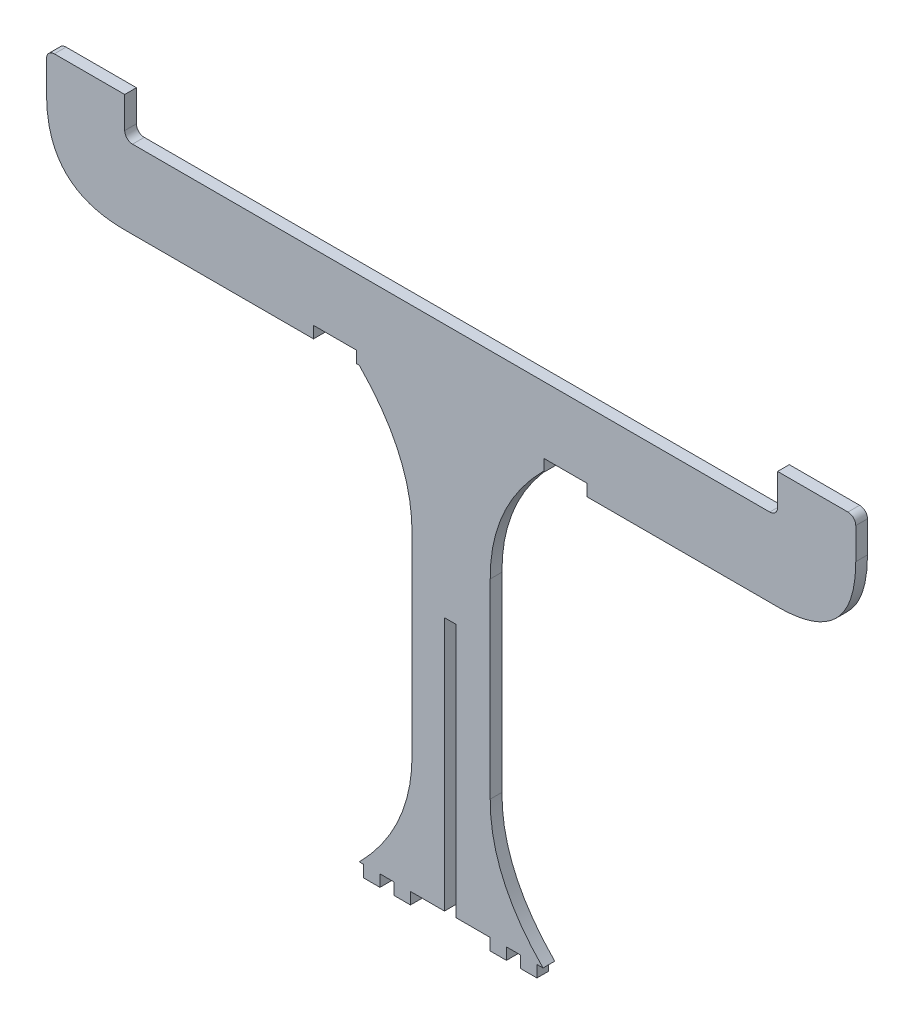
from build123d import *

# Parameters (mm, degrees)
P_IDAT_VYSUNUT_M2_DEPTH  = 3
SKICA2_W                 = 3
SKICA2_H                 = 65
ODEBRAT_VYSUNUT_M3_DEPTH = 3
SKICA3_W                 = 11
SKICA3_H                 = 5.694256757
ODEBRAT_VYSUNUT_M4_DEPTH = 3


with BuildPart() as part:
    # Skica1 → Přidat vysunutím2 (new body)
    with BuildSketch(Plane.XY):
        with BuildLine():
            Line((-90.642636358, 2.694256757), (-30.642636358, 2.694256757))
            add(Edge.make_bspline(
                [(-30.642636358, 2.694256757), (-17.025139471, -11.118063286), (-17.142636358, -27.878389443)],
                knots=[0, 0, 0, 1, 1, 1], degree=2))
            Line((-17.142636358, -27.878389443), (-17.142636358, -76.655981804))
            add(Edge.make_bspline(
                [(-30.642636358, -107.305743243), (-17.009316786, -93.458261678), (-17.142636358, -76.655981804)],
                knots=[0, 0, 0, 1, 1, 1], degree=2))
            Line((-30.642636358, -107.305743243), (-29.497972973, -107.305743243))
            Line((-29.497972973, -107.305743243), (-29.497972973, -110.305743243))
            Line((-29.497972973, -110.305743243), (-25.347972973, -110.305743243))
            Line((-25.347972973, -110.305743243), (-25.347972973, -107.305743243))
            Line((-25.347972973, -107.305743243), (-21.697972973, -107.305743243))
            Line((-21.697972973, -107.305743243), (-21.697972973, -110.305743243))
            Line((-21.697972973, -110.305743243), (-17.547972973, -110.305743243))
            Line((-17.547972973, -110.305743243), (-17.547972973, -107.305743243))
            Line((-17.547972973, -107.305743243), (2.852027027, -107.305743243))
            Line((2.852027027, -107.305743243), (2.852027027, -110.305743243))
            Line((2.852027027, -110.305743243), (7.002027027, -110.305743243))
            Line((7.002027027, -110.305743243), (7.002027027, -107.305743243))
            Line((7.002027027, -107.305743243), (10.652027027, -107.305743243))
            Line((10.652027027, -107.305743243), (10.652027027, -110.305743243))
            Line((10.652027027, -110.305743243), (14.802027027, -110.305743243))
            Line((14.802027027, -110.305743243), (14.802027027, -107.305743243))
            Line((14.802027027, -107.305743243), (16.357363642, -107.305743243))
            add(Edge.make_bspline(
                [(16.357363642, -107.305743243), (2.72404407, -93.458261678), (2.857363642, -76.655981804)],
                knots=[0, 0, 0, 1, 1, 1], degree=2))
            Line((2.857363642, -76.655981804), (2.857363642, -27.878389443))
            add(Edge.make_bspline(
                [(16.357363642, 2.694256757), (2.739866756, -11.118063286), (2.857363642, -27.878389443)],
                knots=[0, 0, 0, 1, 1, 1], degree=2))
            Line((16.357363642, 2.694256757), (76.357363642, 2.694256757))
            add(Edge.make_bspline(
                [(96.357363642, 22.694256757), (96.357363642, 2.694256757), (76.357363642, 2.694256757)],
                knots=[0, 0, 0, 1, 1, 1], degree=2))
            Line((96.357363642, 22.694256757), (96.357363642, 30.694256757))
            ThreePointArc((96.357363642, 30.694256757), (95.771577204, 32.108470319), (94.357363642, 32.694256757))
            Line((94.357363642, 32.694256757), (76.357363642, 32.694256757))
            Line((76.357363642, 32.694256757), (76.357363642, 24.694256757))
            ThreePointArc((76.357363642, 24.694256757), (75.771577204, 23.280043194), (74.357363642, 22.694256757))
            Line((74.357363642, 22.694256757), (-88.642636358, 22.694256757))
            ThreePointArc((-88.642636358, 22.694256757), (-90.05684992, 23.280043194), (-90.642636358, 24.694256757))
            Line((-90.642636358, 24.694256757), (-90.642636358, 32.694256757))
            Line((-90.642636358, 32.694256757), (-108.642636358, 32.694256757))
            ThreePointArc((-108.642636358, 32.694256757), (-110.05684992, 32.108470319), (-110.642636358, 30.694256757))
            Line((-110.642636358, 30.694256757), (-110.642636358, 22.694256757))
            add(Edge.make_bspline(
                [(-110.642636358, 22.694256757), (-110.642636358, 2.694256757), (-90.642636358, 2.694256757)],
                knots=[0, 0, 0, 1, 1, 1], degree=2))
        make_face()
    extrude(amount=P_IDAT_VYSUNUT_M2_DEPTH)

    # Skica2 → Odebrat vysunutím3 (cut)
    with BuildSketch(Plane(origin=(0, 0, 0), x_dir=(-1, 0, 0), z_dir=(0, 0, -1))):
        with Locations((7.347972973, -74.805743243)):
            Rectangle(SKICA2_W, SKICA2_H)
    extrude(amount=-ODEBRAT_VYSUNUT_M3_DEPTH, mode=Mode.SUBTRACT)

    # Skica3 → Odebrat vysunutím4 (cut)
    with BuildSketch(Plane(origin=(0, 0, 0), x_dir=(-1, 0, 0), z_dir=(0, 0, -1))):
        with Locations((-22.152027027, 2.847128379)):
            Rectangle(SKICA3_W, SKICA3_H)
        with Locations((36.847972973, 2.847128379)):
            Rectangle(SKICA3_W, SKICA3_H)
    extrude(amount=-ODEBRAT_VYSUNUT_M4_DEPTH, mode=Mode.SUBTRACT)


solid = part.part
